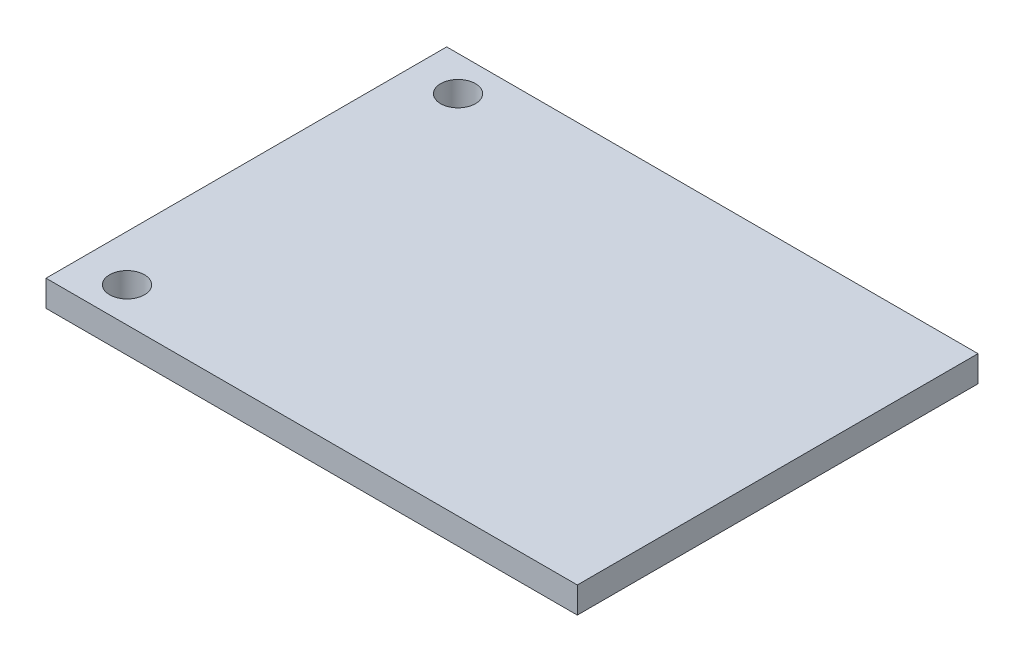
from build123d import *

# Parameters (mm, degrees)
SKETCH1_W           = 30.5
SKETCH1_H           = 23
SKETCH1_R           = 1
BOSS_EXTRUDE1_DEPTH = 1.5


with BuildPart() as part:
    # Sketch1 → Boss-Extrude1 (new body)
    with BuildSketch(Plane(origin=(0, 0, 0), x_dir=(1, 0, 0), z_dir=(0, 1, 0))):
        Rectangle(SKETCH1_W, SKETCH1_H)
        with Locations(Location((-12.597826087, 9.5, 0), (0, 0, 270))):
            Circle(SKETCH1_R, mode=Mode.SUBTRACT)
        with Locations(Location((-12.597826087, -9.5, 0), (0, 0, 270))):
            Circle(SKETCH1_R, mode=Mode.SUBTRACT)
    extrude(amount=BOSS_EXTRUDE1_DEPTH)


solid = part.part
